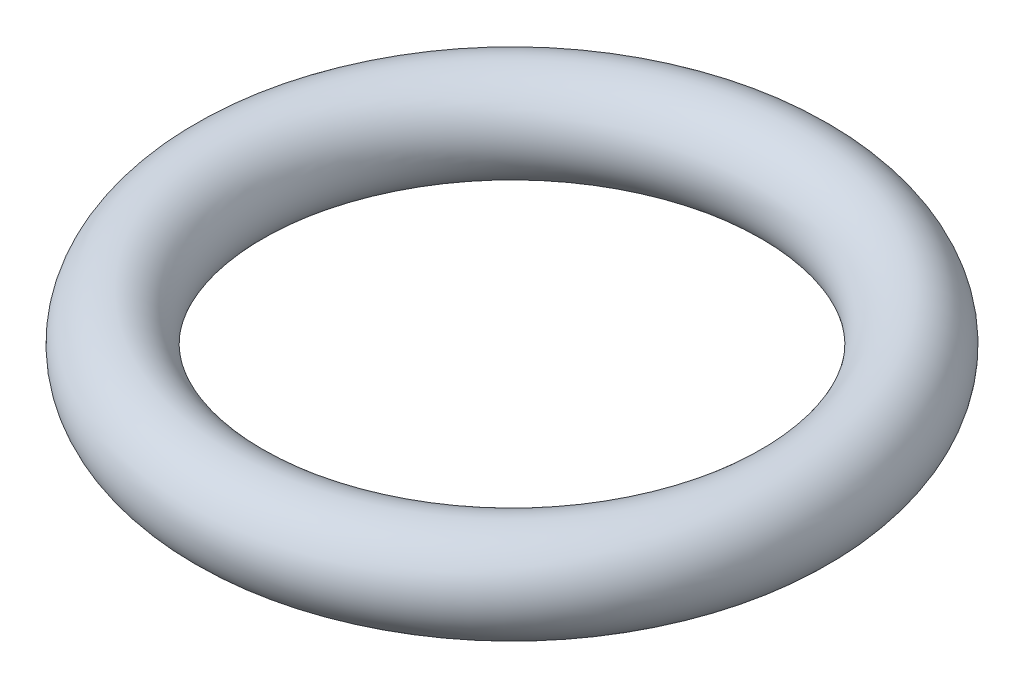
from build123d import *

# Parameters (mm, degrees)
SKETCH1_R = 3.175


with BuildPart() as part:
    # Sketch1 → Revolve1 (revolve)
    with BuildSketch(Plane.XY, mode=Mode.PRIVATE) as revolve1_sk:
        with Locations((19.05, 0)):
            Circle(SKETCH1_R)
    revolve(revolve1_sk.sketch.rotate(Axis((0, 0, 0), (0, 1, 0)), 90), axis=Axis((0, 0, 0), (0, 1, 0)))


solid = part.part
